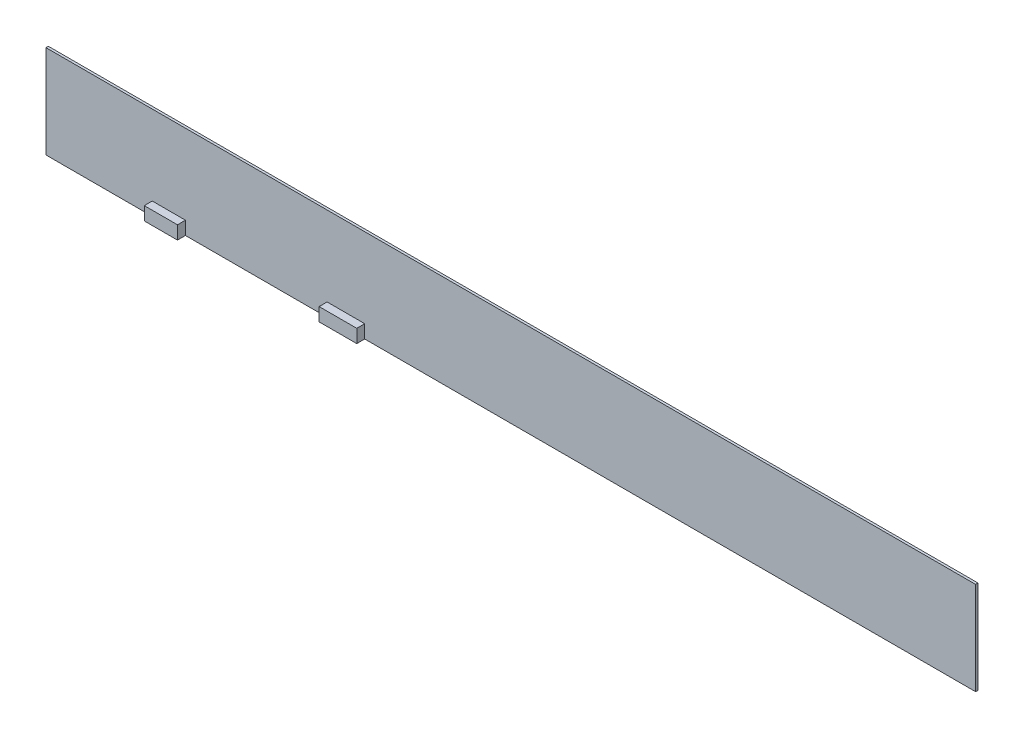
from build123d import *

# Parameters (mm, degrees)
SKETCH_1_W      = 2100
SKETCH_1_H      = 210
EXTRUDE_1_DEPTH = 5.4
SKETCH_2_W      = 75
SKETCH_2_H      = 30
SKETCH_2_W_2    = 85
EXTRUDE_2_DEPTH = 18
SKETCH_4_W      = 1968
SKETCH_4_H      = 182
EXTRUDE_3_DEPTH = 0.2


with BuildPart() as part:
    # 草图1 → 凸台-拉伸1 (new body)
    with BuildSketch(Plane.XY):
        with Locations((1050, 105)):
            Rectangle(SKETCH_1_W, SKETCH_1_H)
    extrude(amount=EXTRUDE_1_DEPTH)

    # 草图2 → 凸台-拉伸2 (add)
    with BuildSketch(Plane.XY.offset(5.4)):
        with Locations((277.5, 15)):
            Rectangle(SKETCH_2_W, SKETCH_2_H)
        with Locations((677.5, 15)):
            Rectangle(SKETCH_2_W_2, SKETCH_2_H)
    extrude(amount=EXTRUDE_2_DEPTH)

    # 草图4 → 凸台-拉伸3 (add)
    with BuildSketch(Plane(origin=(0, 0, 0), x_dir=(-1, 0, 0), z_dir=(0, 0, -1))):
        with Locations((-1050, 109)):
            Rectangle(SKETCH_4_W, SKETCH_4_H)
    extrude(amount=EXTRUDE_3_DEPTH)


solid = part.part
